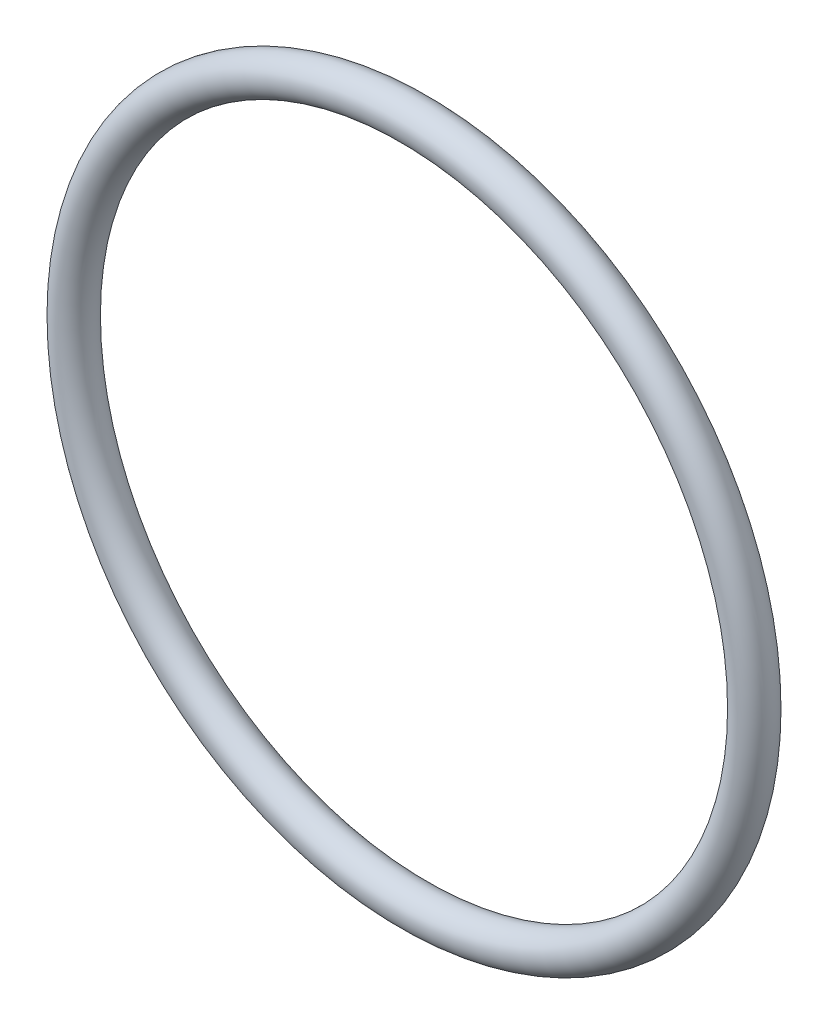
from build123d import *

# Parameters (mm, degrees)
SKETCH1_R = 1.5


with BuildPart() as part:
    # Sketch1 → Revolve1 (revolve)
    with BuildSketch(Plane(origin=(0, 0, 0), x_dir=(0, -1, 0), z_dir=(1, 0, 0)), mode=Mode.PRIVATE) as revolve1_sk:
        with Locations((27, 0)):
            Circle(SKETCH1_R)
    revolve(revolve1_sk.sketch.rotate(Axis((0, 0, 1.5), (0, 0, -1)), 270), axis=Axis((0, 0, 1.5), (0, 0, -1)))


solid = part.part
